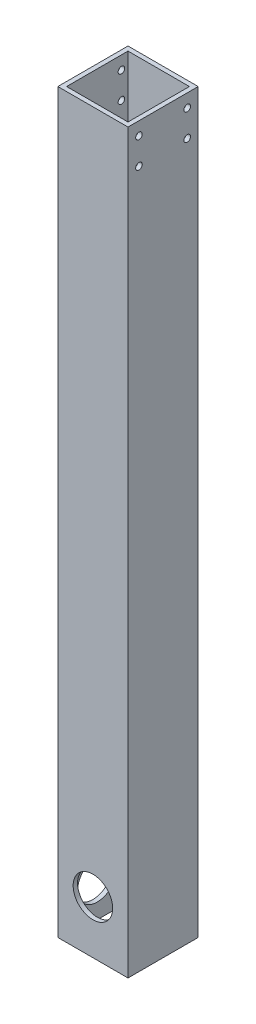
from build123d import *

# Parameters (mm, degrees)
SKETCH1_W           = 50.8
SKETCH1_H           = 50.8
SKETCH1_W_2         = 44.45
SKETCH1_H_2         = 44.45
BOSS_EXTRUDE1_DEPTH = 533.4
SKETCH2_R           = 14.2875
CUT_EXTRUDE1_DEPTH  = 3.175
SKETCH3_R           = 14.3002
CUT_EXTRUDE2_DEPTH  = 537.415286881
SKETCH4_R           = 2.38125
CUT_EXTRUDE3_DEPTH  = 537.415286881


with BuildPart() as part:
    # Sketch1 → Boss-Extrude1 (new body)
    with BuildSketch(Plane(origin=(0, 0, 0), x_dir=(1, 0, 0), z_dir=(0, 1, 0))):
        Rectangle(SKETCH1_W, SKETCH1_H)
        Rectangle(SKETCH1_W_2, SKETCH1_H_2, mode=Mode.SUBTRACT)
    extrude(amount=BOSS_EXTRUDE1_DEPTH)

    # Sketch2 → Cut-Extrude1 (cut)
    with BuildSketch(Plane.ZY.offset(25.4)):
        with Locations((0, 25.4)):
            Circle(SKETCH2_R)
    extrude(amount=-CUT_EXTRUDE1_DEPTH, mode=Mode.SUBTRACT)

    # Sketch3 → Cut-Extrude2 (cut, through all)
    with BuildSketch(Plane(origin=(0, 0, -25.4), x_dir=(-1, 0, 0), z_dir=(0, 0, -1))):
        with Locations((0, 38.1)):
            Circle(SKETCH3_R)
    extrude(amount=-CUT_EXTRUDE2_DEPTH, mode=Mode.SUBTRACT)

    # Sketch4 → Cut-Extrude3 (cut, through all)
    with BuildSketch(Plane.ZY.offset(25.4)):
        with Locations((17.4625, 523.875)):
            Circle(SKETCH4_R)
        with Locations((17.4625, 504.825)):
            Circle(SKETCH4_R)
        with Locations((-17.4625, 504.825)):
            Circle(SKETCH4_R)
        with Locations((-17.4625, 523.875)):
            Circle(SKETCH4_R)
    extrude(amount=-CUT_EXTRUDE3_DEPTH, mode=Mode.SUBTRACT)


solid = part.part
